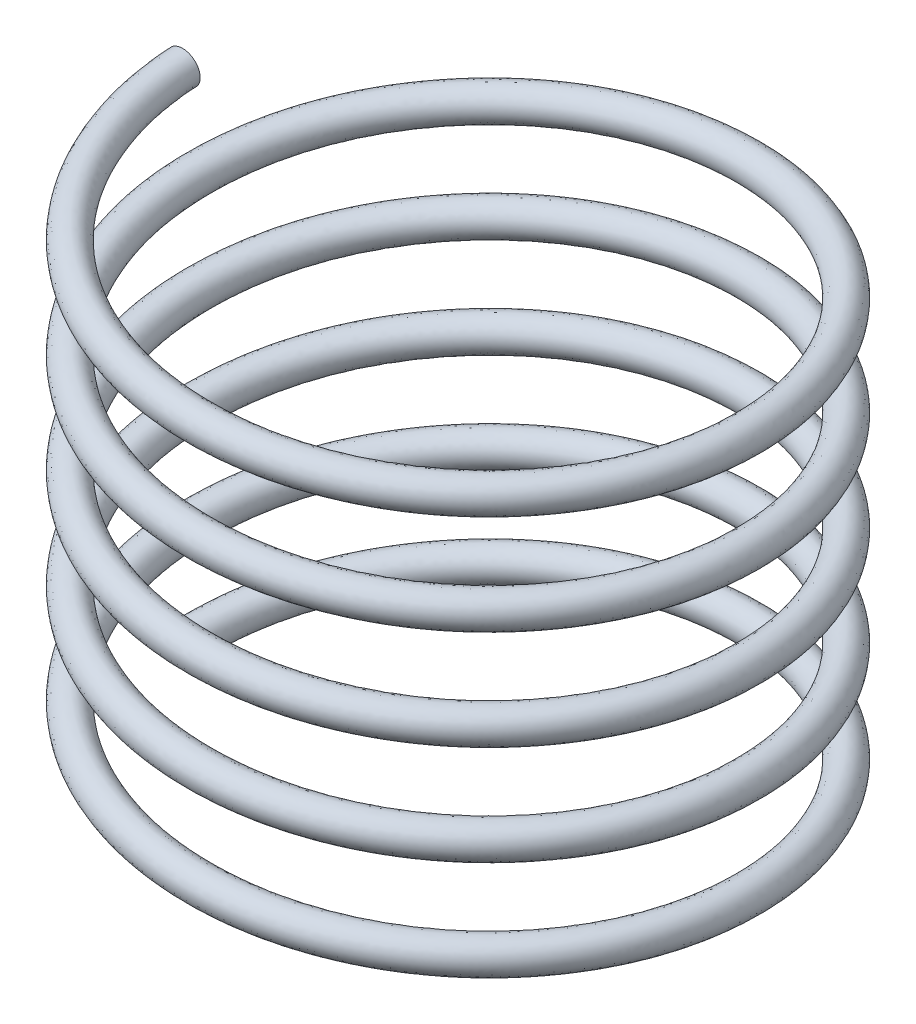
from build123d import *

# Parameters (mm, degrees)
SWEEP1_PITCH       = 2.4
SWEEP1_HEIGHT      = 12
SWEEP1_RADIUS      = 6.6
SWEEP1_START_ANGLE = -90
SWEEP1_PROFILE_R   = 0.4


with BuildPart() as part:
    # Sweep1: sweep along a helix
    with BuildLine() as sweep1_path:
        add(Helix(SWEEP1_PITCH, SWEEP1_HEIGHT, SWEEP1_RADIUS, center=(0, 0, 0), direction=(0, 1, 0), lefthand=True, mode=Mode.PRIVATE).rotate(Axis((0, 0, 0), (0, 1, 0)), SWEEP1_START_ANGLE))
    # Sweep1 profile (on start of the path) → Sweep1 (sweep)
    with BuildSketch(Plane(origin=(-6.6, 0, 0), x_dir=(0, -0.9983294650657021, -0.05777784334525749), z_dir=(1.6155358066333878e-14, 0.05777784334525749, -0.9983294650657021))):
        Circle(SWEEP1_PROFILE_R)
    sweep(path=sweep1_path.line, is_frenet=True)


solid = part.part
